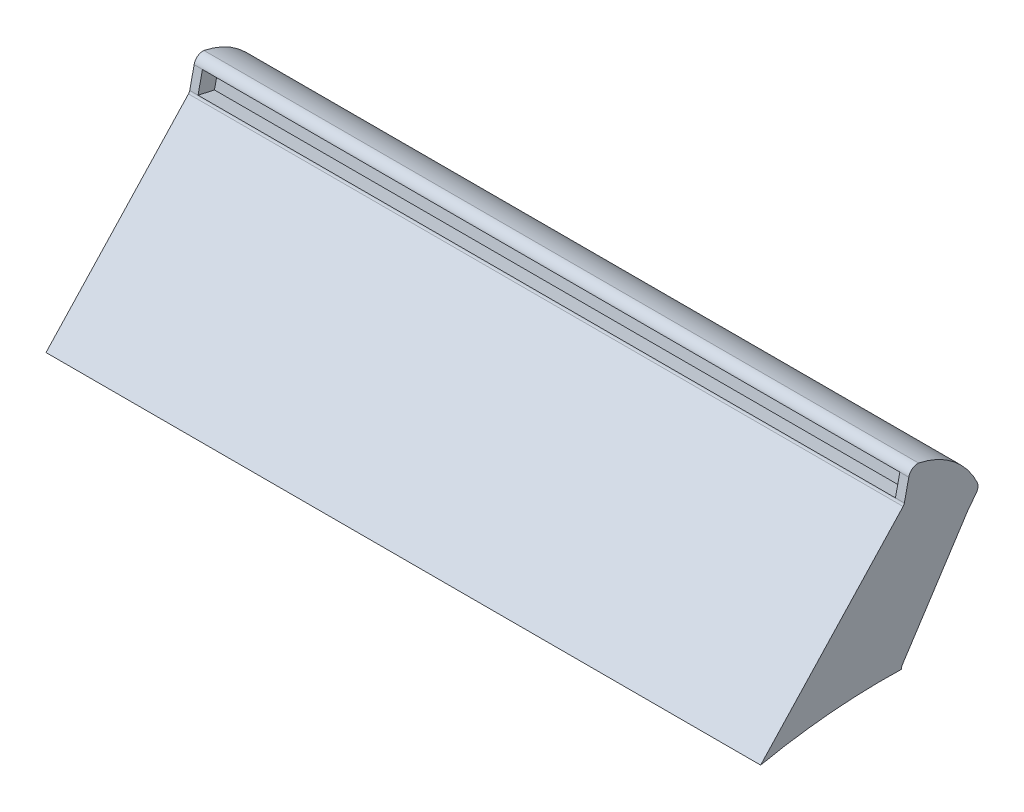
from build123d import *

# Parameters (mm, degrees)
BOSS_EXTRUDE1_DEPTH = 850
SKETCH2_W           = 829.503147771
SKETCH2_H           = 24.520289532
CUT_EXTRUDE1_DEPTH  = 20


with BuildPart() as part:
    # Sketch1 → Boss-Extrude1 (new body)
    with BuildSketch(Plane(origin=(0, 0, 0), x_dir=(0, 0, -1), z_dir=(1, 0, 0))):
        with BuildLine():
            Line((-147.74064655, -92.809040889), (21.737933493, 88.875862637))
            add(Edge.make_bspline(
                [(21.737933493, 88.875862637), (22.846353546, 90.074456327), (23.208127069, 91.669385546)],
                knots=[0, 0, 0, 1, 1, 1], degree=2))
            Line((23.208127069, 91.669385546), (28.470152179, 115.618408292))
            ThreePointArc((28.470152179, 115.618408292), (32.569812262, 122.282745924), (40.094456308, 124.427586441))
            ThreePointArc((40.094456308, 124.427586441), (81.491387891, 105.200191819), (109.979351041, 69.537401631))
            ThreePointArc((109.979351041, 69.537401631), (110.794083493, 64.647138854), (109.33864767, 59.907923142))
            Line((109.33864767, 59.907923142), (99.458915624, 47.413226279))
            Line((99.458915624, 47.413226279), (20.929242749, -73.511865602))
            ThreePointArc((20.929242749, -73.511865602), (19.968049413, -75.596855125), (19.638607292, -77.868977882))
            ThreePointArc((19.638607292, -77.868977882), (-64.487922257, -80.444221731), (-147.74064655, -92.809040889))
        make_face()
    extrude(amount=BOSS_EXTRUDE1_DEPTH)

    # Sketch2 → Cut-Extrude1 (cut)
    with BuildSketch(Plane(origin=(0, -0.642785482, -2.925505639), x_dir=(1, 0, 0), z_dir=(0, 0.21459881636528488, 0.9767022821794873))):
        with Locations((424.628691519, 106.774279434)):
            Rectangle(SKETCH2_W, SKETCH2_H)
    extrude(amount=-CUT_EXTRUDE1_DEPTH, mode=Mode.SUBTRACT)


solid = part.part
